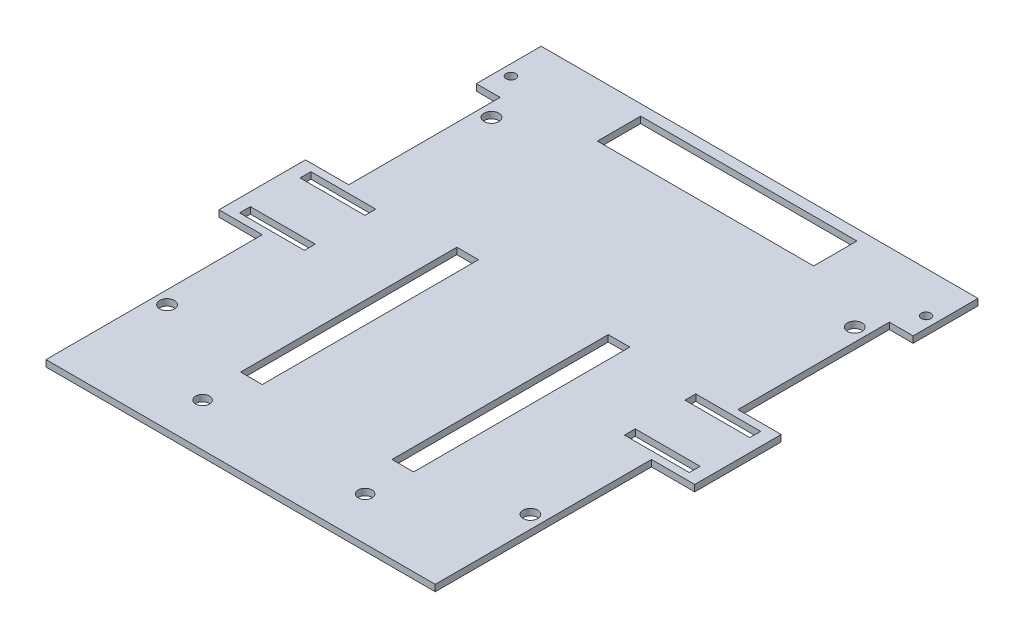
from build123d import *

# Parameters (mm, degrees)
SKETCH1_R           = 1.1
SKETCH1_R_2         = 1.7
SKETCH1_R_3         = 1.6
SKETCH1_W           = 50
SKETCH1_H           = 10
SKETCH1_W_2         = 15
SKETCH1_H_2         = 2.5
SKETCH1_W_3         = 5
SKETCH1_H_3         = 50
BOSS_EXTRUDE1_DEPTH = 1.5


with BuildPart() as part:
    # Sketch1 → Boss-Extrude1 (new body)
    with BuildSketch(Plane(origin=(0, 0, 0), x_dir=(1, 0, 0), z_dir=(0, 1, 0))):
        Polygon((-45, 105), (-50.5, 105), (-50.5, 120), (50.5, 120), (50.5, 105), (45, 105), (45, 70), (55, 70), (55, 50), (45, 50), (45, 0), (-45, 0), (-45, 50), (-55, 50), (-55, 70), (-45, 70), align=None)
        with Locations(Location((48, 110.5, 0), (0, 0, 270))):
            Circle(SKETCH1_R, mode=Mode.SUBTRACT)
        with Locations(Location((-48, 110.5, 0), (0, 0, 270))):
            Circle(SKETCH1_R, mode=Mode.SUBTRACT)
        with Locations(Location((42, 100, 0), (0, 0, 270))):
            Circle(SKETCH1_R_2, mode=Mode.SUBTRACT)
        with Locations(Location((-42, 100, 0), (0, 0, 270))):
            Circle(SKETCH1_R_2, mode=Mode.SUBTRACT)
        with Locations(Location((-42, 25, 0), (0, 0, 270))):
            Circle(SKETCH1_R_2, mode=Mode.SUBTRACT)
        with Locations(Location((42, 25, 0), (0, 0, 270))):
            Circle(SKETCH1_R_2, mode=Mode.SUBTRACT)
        with Locations(Location((-18.8, 10, 0), (0, 0, 270))):
            Circle(SKETCH1_R_3, mode=Mode.SUBTRACT)
        with Locations(Location((18.8, 10, 0), (0, 0, 270))):
            Circle(SKETCH1_R_3, mode=Mode.SUBTRACT)
        with Locations((0, 112.5)):
            Rectangle(SKETCH1_W, SKETCH1_H, mode=Mode.SUBTRACT)
        with Locations((-44.5, 67)):
            Rectangle(SKETCH1_W_2, SKETCH1_H_2, mode=Mode.SUBTRACT)
        with Locations((-44.5, 53)):
            Rectangle(SKETCH1_W_2, SKETCH1_H_2, mode=Mode.SUBTRACT)
        with Locations((44.5, 53)):
            Rectangle(SKETCH1_W_2, SKETCH1_H_2, mode=Mode.SUBTRACT)
        with Locations((17.5, 45)):
            Rectangle(SKETCH1_W_3, SKETCH1_H_3, mode=Mode.SUBTRACT)
        with Locations((-17.5, 45)):
            Rectangle(SKETCH1_W_3, SKETCH1_H_3, mode=Mode.SUBTRACT)
        with Locations((44.5, 67)):
            Rectangle(SKETCH1_W_2, SKETCH1_H_2, mode=Mode.SUBTRACT)
    extrude(amount=BOSS_EXTRUDE1_DEPTH)


solid = part.part
